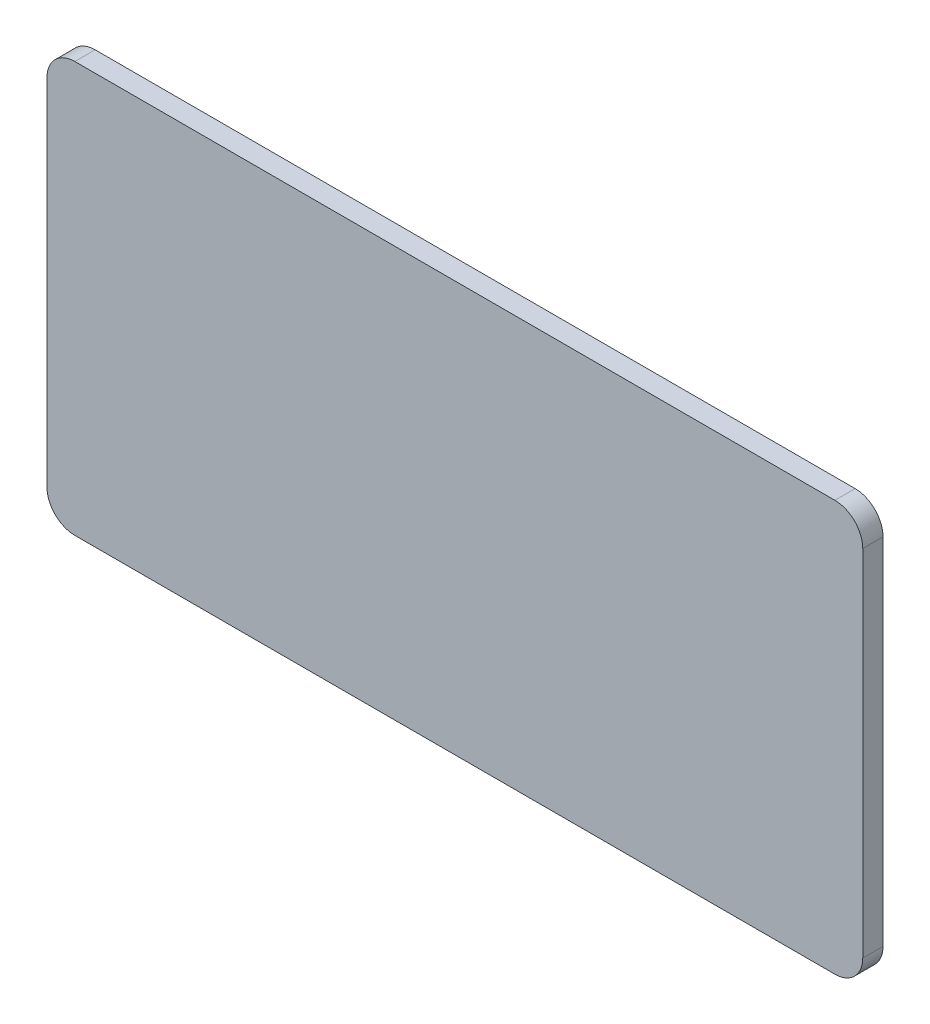
from build123d import *

# Parameters (mm, degrees)
BOSS_EXTRUDE1_DEPTH = 8


with BuildPart() as part:
    # Sketch1 → Boss-Extrude1 (new body)
    with BuildSketch(Plane.XY):
        with BuildLine():
            Line((161, 70), (161, -70))
            ThreePointArc((161, -70), (157.778174593, -77.778174593), (150, -81))
            Line((150, -81), (-150, -81))
            ThreePointArc((-150, -81), (-157.778174593, -77.778174593), (-161, -70))
            Line((-161, -70), (-161, 70))
            ThreePointArc((-161, 70), (-157.778174593, 77.778174593), (-150, 81))
            Line((-150, 81), (0, 81))
            Line((0, 81), (150, 81))
            ThreePointArc((150, 81), (157.778174593, 77.778174593), (161, 70))
        make_face()
    extrude(amount=BOSS_EXTRUDE1_DEPTH)


solid = part.part
